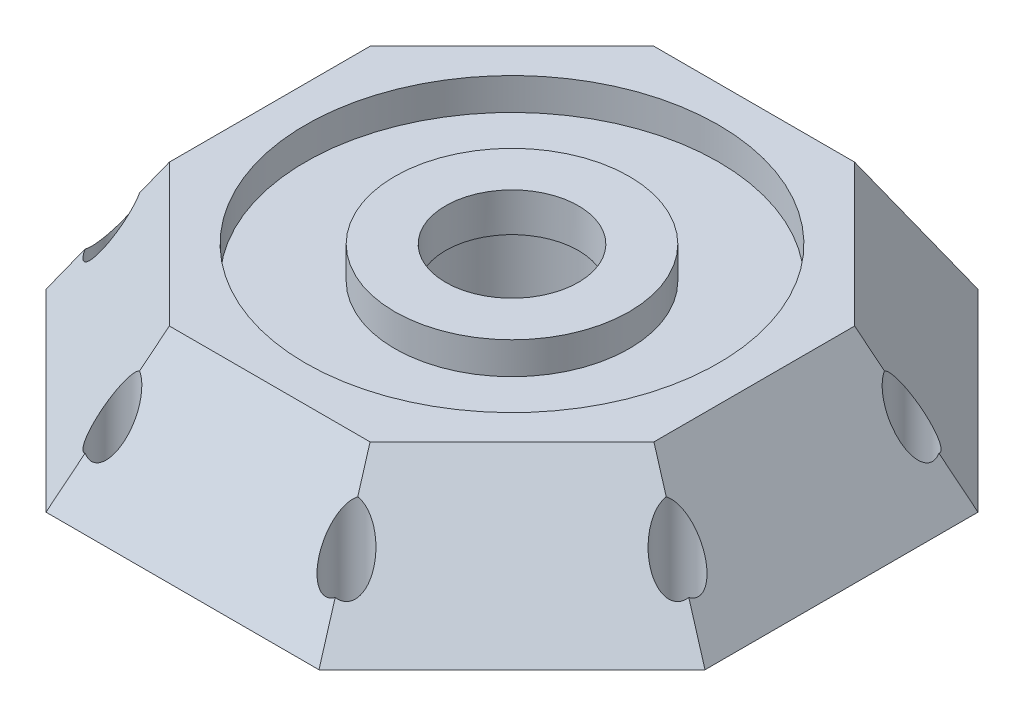
from build123d import *

# Parameters (mm, degrees)
SKETCH_4_R          = 6.85
SKETCH_4_R_2        = 2.15
CUT_EXTRUDE_1_DEPTH = 51.079936266
SKETCH_6_R          = 21.3
SKETCH_6_R_2        = 12.1
CUT_EXTRUDE_3_DEPTH = 3.3
SKETCH_7_R          = 7.85
CUT_EXTRUDE_4_DEPTH = 10


with BuildPart() as part:
    # 草图3 → 放样1 section 0
    with BuildSketch(Plane(origin=(0, 14, 0), x_dir=(1, 0, 0), z_dir=(0, 1, 0))):
        with BuildLine():
            Line((25, 10.355339059), (10.355339059, 25))
            Line((10.355339059, 25), (-10.355339059, 25))
            Line((-10.355339059, 25), (-25, 10.355339059))
            Line((-25, 10.355339059), (-25, -10.355339059))
            Line((-25, -10.355339059), (-10.355339059, -25))
            Line((-10.355339059, -25), (10.355339059, -25))
            Line((10.355339059, -25), (25, -10.355339059))
            Line((25, -10.355339059), (25, 10.355339059))
        make_face()
    # 草图1 → 放样1 section 1
    with BuildSketch(Plane(origin=(0, 0, 0), x_dir=(1, 0, 0), z_dir=(0, 1, 0))):
        with BuildLine():
            Line((34, -14.083261121), (34, 14.083261121))
            Line((34, 14.083261121), (14.083261121, 34))
            Line((14.083261121, 34), (-14.083261121, 34))
            Line((-14.083261121, 34), (-34, 14.083261121))
            Line((-34, 14.083261121), (-34, -14.083261121))
            Line((-34, -14.083261121), (-14.083261121, -34))
            Line((-14.083261121, -34), (14.083261121, -34))
            Line((14.083261121, -34), (34, -14.083261121))
        make_face()
    loft()

    # 草图4 → 切除-拉伸1 (cut, through all)
    with BuildSketch(Plane(origin=(0, 14, 0), x_dir=(1, 0, 0), z_dir=(0, 1, 0))):
        with Locations(Location((0, 0, 0), (0, 0, 270))):
            Circle(SKETCH_4_R)
        with Locations(Location((-29.157457896, 12.077414505, 0), (0, 0, 270))):
            Circle(SKETCH_4_R_2)
        with Locations(Location((29.157457896, 12.077414505, 0), (0, 0, 270))):
            Circle(SKETCH_4_R_2)
        with Locations(Location((29.157457896, -12.077414505, 0), (0, 0, 270))):
            Circle(SKETCH_4_R_2)
        with Locations(Location((12.077414505, -29.157457896, 0), (0, 0, 270))):
            Circle(SKETCH_4_R_2)
        with Locations(Location((-12.077414505, -29.157457896, 0), (0, 0, 270))):
            Circle(SKETCH_4_R_2)
        with Locations(Location((-29.157457896, -12.077414505, 0), (0, 0, 270))):
            Circle(SKETCH_4_R_2)
    extrude(amount=-CUT_EXTRUDE_1_DEPTH, mode=Mode.SUBTRACT)

    # 草图6 → 切除-拉伸3 (cut)
    with BuildSketch(Plane(origin=(0, 14, 0), x_dir=(1, 0, 0), z_dir=(0, 1, 0))):
        with Locations(Location((0, 0, 0), (0, 0, 270))):
            Circle(SKETCH_6_R)
        with Locations(Location((0, 0, 0), (0, 0, 270))):
            Circle(SKETCH_6_R_2, mode=Mode.SUBTRACT)
    extrude(amount=-CUT_EXTRUDE_3_DEPTH, mode=Mode.SUBTRACT)

    # 草图7 → 切除-拉伸4 (cut)
    with BuildSketch(Plane.XZ):
        with Locations(Location((0, 0, 0), (0, 0, 270))):
            Circle(SKETCH_7_R)
    extrude(amount=-CUT_EXTRUDE_4_DEPTH, mode=Mode.SUBTRACT)


solid = part.part
